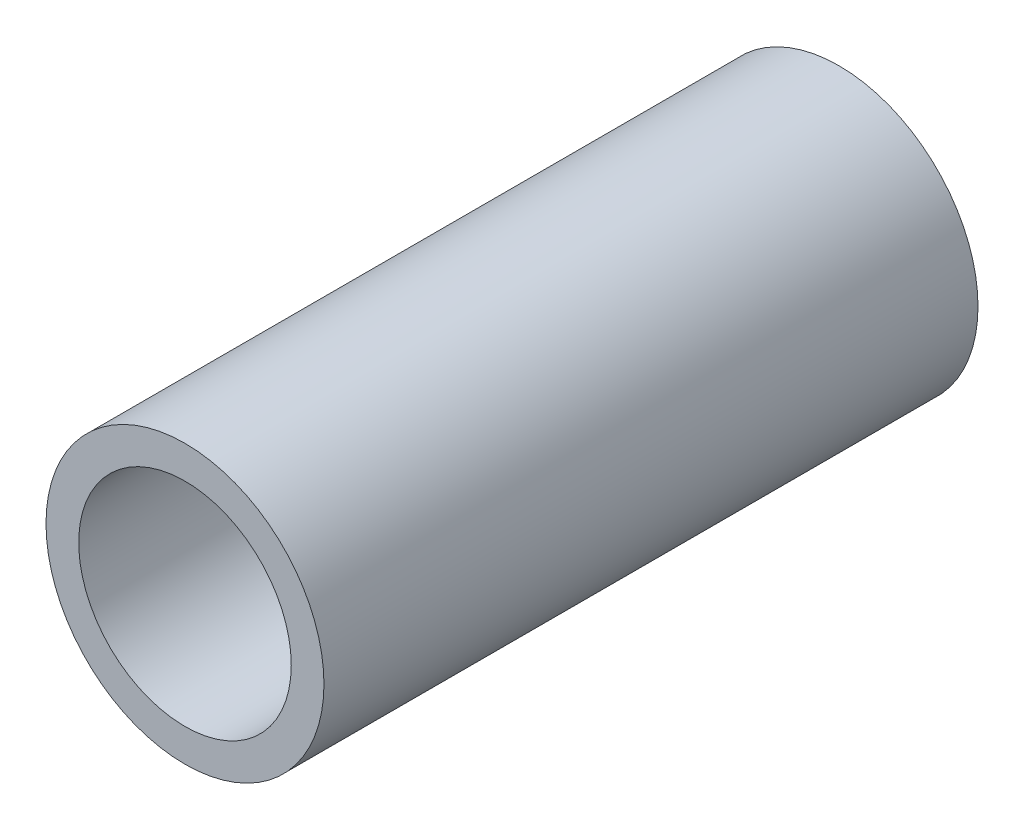
from build123d import *

# Parameters (mm, degrees)
SKETCH_1_R      = 17
SKETCH_1_R_2    = 13
EXTRUDE_1_DEPTH = 80


with BuildPart() as part:
    # 草图1 → 拉伸1 (new body)
    with BuildSketch(Plane.XY):
        Circle(SKETCH_1_R)
        Circle(SKETCH_1_R_2, mode=Mode.SUBTRACT)
    extrude(amount=EXTRUDE_1_DEPTH)


solid = part.part
